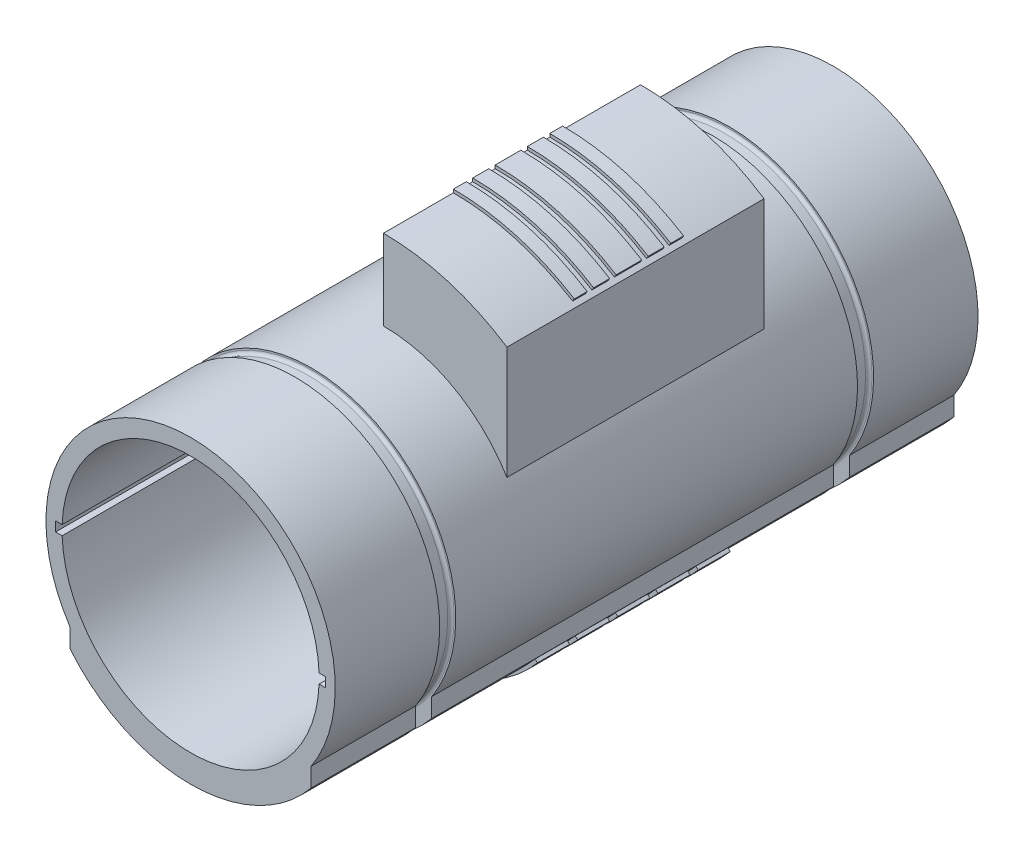
from build123d import *

# Parameters (mm, degrees)
ESBO_O1_R                     = 45
RESSALTO_EXTRUS_O1_DEPTH      = 200
ESBO_O2_R                     = 40
CORTE_EXTRUS_O2_DEPTH         = 200
RESSALTO_EXTRUS_O2_DEPTH      = 200
ESBO_O6_W                     = 10
ESBO_O6_H                     = 1
REVOLU_O1_ANGLE               = 50
REVOLU_O1_OTHER_WAY_ANGLE     = 50
RESSALTO_EXTRUS_O6_DEPTH      = 40
RESSALTO_EXTRUS_O6_DEPTH_BACK = 40
CORTE_EXTRUS_O3_DEPTH         = 12
CORTE_REVOLU_O5_ANGLE         = 180
ESBO_O20_W                    = 4
ESBO_O20_H                    = 1
ESBO_O20_W_2                  = 5
ESBO_O20_W_3                  = 8
REVOLU_O3_ANGLE               = 32
ESBO_O21_W                    = 2.028134895
ESBO_O21_H                    = 3
RESSALTO_EXTRUS_O8_DEPTH      = 3


with BuildPart() as part:
    # Esboço1 → Ressalto-extrusão1 (new body)
    with BuildSketch(Plane.XY):
        Circle(ESBO_O1_R)
    extrude(amount=RESSALTO_EXTRUS_O1_DEPTH)

    # Esboço2 → Corte-extrusão2 (cut)
    with BuildSketch(Plane.XY):
        Circle(ESBO_O2_R)
        Polygon((0, -1.5), (42, -1.5), (42, 1.5), (-42, 1.5), (-42, -1.5), align=None)
    extrude(amount=CORTE_EXTRUS_O2_DEPTH, mode=Mode.SUBTRACT)

    # Esboço4 → Ressalto-extrusão2 (add)
    with BuildSketch(Plane.XY):
        with BuildLine():
            Line((-37.5, -24.874685928), (-37.5, -30.757112998))
            ThreePointArc((-37.5, -30.757112998), (0, -48.5), (37.5, -30.757112998))
            Line((37.5, -30.757112998), (37.5, -24.874685928))
            ThreePointArc((37.5, -24.874685928), (36.193272903, -26.740362685), (34.793814433, -28.537527524))
            ThreePointArc((34.793814433, -28.537527524), (0, -45), (-34.793814433, -28.537527524))
            ThreePointArc((-34.793814433, -28.537527524), (-36.193272903, -26.740362685), (-37.5, -24.874685928))
        make_face()
    extrude(amount=RESSALTO_EXTRUS_O2_DEPTH)

    # Esboço6 → Revolução1 (revolve)
    with BuildSketch(Plane(origin=(0, 0, 0), x_dir=(0, 0, -1), z_dir=(1, 0, 0))):
        Polygon((-75, -48.5), (-80, -48.5), (-80, -49.5), (-70, -49.5), (-70, -48.5), align=None)
        Polygon((-105, -49.5), (-105, -48.5), (-100, -48.5), (-95, -48.5), (-95, -49.5), align=None)
        with Locations((-125, -49)):
            Rectangle(ESBO_O6_W, ESBO_O6_H)
        Polygon((-92.5, -49.5), (-82.5, -49.5), (-82.5, -48.5), (-87.5, -48.5), (-92.5, -48.5), align=None)
        with Locations((-112.5, -49)):
            Rectangle(ESBO_O6_W, ESBO_O6_H)
    revolve(axis=Axis((0, 0, 0), (0, 0, 1)), revolution_arc=REVOLU_O1_ANGLE)

    # Esboço6 → Revolução1 other way (revolve)
    with BuildSketch(Plane(origin=(0, 0, 0), x_dir=(0, 0, -1), z_dir=(1, 0, 0))):
        Polygon((-75, -48.5), (-80, -48.5), (-80, -49.5), (-70, -49.5), (-70, -48.5), align=None)
        Polygon((-105, -49.5), (-105, -48.5), (-100, -48.5), (-95, -48.5), (-95, -49.5), align=None)
        with Locations((-125, -49)):
            Rectangle(ESBO_O6_W, ESBO_O6_H)
        Polygon((-92.5, -49.5), (-82.5, -49.5), (-82.5, -48.5), (-87.5, -48.5), (-92.5, -48.5), align=None)
        with Locations((-112.5, -49)):
            Rectangle(ESBO_O6_W, ESBO_O6_H)
    revolve(axis=Axis((0, 0, 0), (0, 0, -1)), revolution_arc=REVOLU_O1_OTHER_WAY_ANGLE)

    # Esboço7 → Corte-Revolução3 (revolve, cut)
    with BuildSketch(Plane(origin=(0, 0, 0), x_dir=(0, 0, -1), z_dir=(1, 0, 0)), mode=Mode.PRIVATE) as corte_revolu_o3_sk:
        with BuildLine():
            Line((-165, -48.5), (-162.5, -48.5))
            Line((-162.5, -48.5), (-162.5, -47.198708602))
            Line((-162.5, -47.198708602), (-162.5, -44.5))
            ThreePointArc((-162.5, -44.5), (-162.792893219, -43.792893219), (-163.5, -43.5))
            Line((-163.5, -43.5), (-166.5, -43.5))
            ThreePointArc((-166.5, -43.5), (-167.207106781, -43.792893219), (-167.5, -44.5))
            Line((-167.5, -44.5), (-167.5, -48.5))
            Line((-167.5, -48.5), (-165, -48.5))
        make_face()
        with BuildLine():
            Line((-37.5, -48.5), (-37.5, -44.5))
            ThreePointArc((-37.5, -44.5), (-37.207106781, -43.792893219), (-36.5, -43.5))
            Line((-36.5, -43.5), (-33.5, -43.5))
            ThreePointArc((-33.5, -43.5), (-32.792893219, -43.792893219), (-32.5, -44.5))
            Line((-32.5, -44.5), (-32.5, -47.198708602))
            Line((-32.5, -47.198708602), (-32.5, -48.5))
            Line((-32.5, -48.5), (-37.5, -48.5))
        make_face()
    revolve(corte_revolu_o3_sk.sketch.rotate(Axis((0, 0, 0), (0, 0, 1)), 270), axis=Axis((0, 0, 0), (0, 0, 1)), mode=Mode.SUBTRACT)

    # Esboço17 → Ressalto-extrusão6 (add, two sides: drawn at the far end of the back side and taken through both)
    with BuildSketch(Plane(origin=(0, 0, 100), x_dir=(-1, 0, 0), z_dir=(0, 0, -1)).offset(-RESSALTO_EXTRUS_O6_DEPTH_BACK)):
        with BuildLine():
            Line((0, 45), (0, 70))
            ThreePointArc((0, 70), (-20.056825735, 67.065070949), (-38.431784027, 58.506392612))
            Line((-38.431784027, 58.506392612), (-38.431784027, 23.409356601))
            ThreePointArc((-38.431784027, 23.409356601), (-22.040632397, 39.23277359), (0, 45))
        make_face()
    extrude(amount=RESSALTO_EXTRUS_O6_DEPTH + RESSALTO_EXTRUS_O6_DEPTH_BACK)

    # Esboço18 → Corte-extrusão3 (cut)
    with BuildSketch(Plane(origin=(0, 0, 0), x_dir=(0, 0, -1), z_dir=(1, 0, 0))):
        with BuildLine():
            ThreePointArc((-95, 55), (-87, 47), (-79, 55))
            Line((-79, 55), (-95, 55))
        make_face()
        with BuildLine():
            Line((-95, 55), (-79, 55))
            ThreePointArc((-79, 55), (-87, 63), (-95, 55))
        make_face()
        with BuildLine():
            ThreePointArc((-121, 55), (-113, 47), (-105, 55))
            Line((-105, 55), (-121, 55))
        make_face()
        with BuildLine():
            Line((-121, 55), (-105, 55))
            ThreePointArc((-105, 55), (-113, 63), (-121, 55))
        make_face()
    extrude(amount=CORTE_EXTRUS_O3_DEPTH, mode=Mode.SUBTRACT)

    # Esboço19 → Corte-Revolução5 (revolve, cut)
    with BuildSketch(Plane.ZY.offset(-12)):
        Polygon((100, 45), (77.5, 45), (77.5, 65), (122.5, 65), (122.5, 45), align=None)
    revolve(axis=Axis((12, 45, 100), (0, 0, -1)), revolution_arc=CORTE_REVOLU_O5_ANGLE, mode=Mode.SUBTRACT)

    # Esboço20 → Revolução3 (revolve)
    with BuildSketch(Plane(origin=(0, 0, 0), x_dir=(0, 0, -1), z_dir=(1, 0, 0))):
        with Locations((-86.242439745, 70.5)):
            Rectangle(ESBO_O20_W, ESBO_O20_H)
        with Locations((-92.742439745, 70.5)):
            Rectangle(ESBO_O20_W_2, ESBO_O20_H)
        with Locations((-101.242439745, 70.5)):
            Rectangle(ESBO_O20_W_3, ESBO_O20_H)
        with Locations((-109.742439745, 70.5)):
            Rectangle(ESBO_O20_W_2, ESBO_O20_H)
        with Locations((-116.242439745, 70.5)):
            Rectangle(ESBO_O20_W, ESBO_O20_H)
    revolve(axis=Axis((0, 0, 0), (0, 0, -1)), revolution_arc=REVOLU_O3_ANGLE)

    # Esboço21 → Ressalto-extrusão8 (add)
    with BuildSketch(Plane.XY):
        with Locations((40.985932553, 0)):
            Rectangle(ESBO_O21_W, ESBO_O21_H)
        with Locations((-40.985932553, 0)):
            Rectangle(ESBO_O21_W, ESBO_O21_H)
    extrude(amount=RESSALTO_EXTRUS_O8_DEPTH)


solid = part.part
